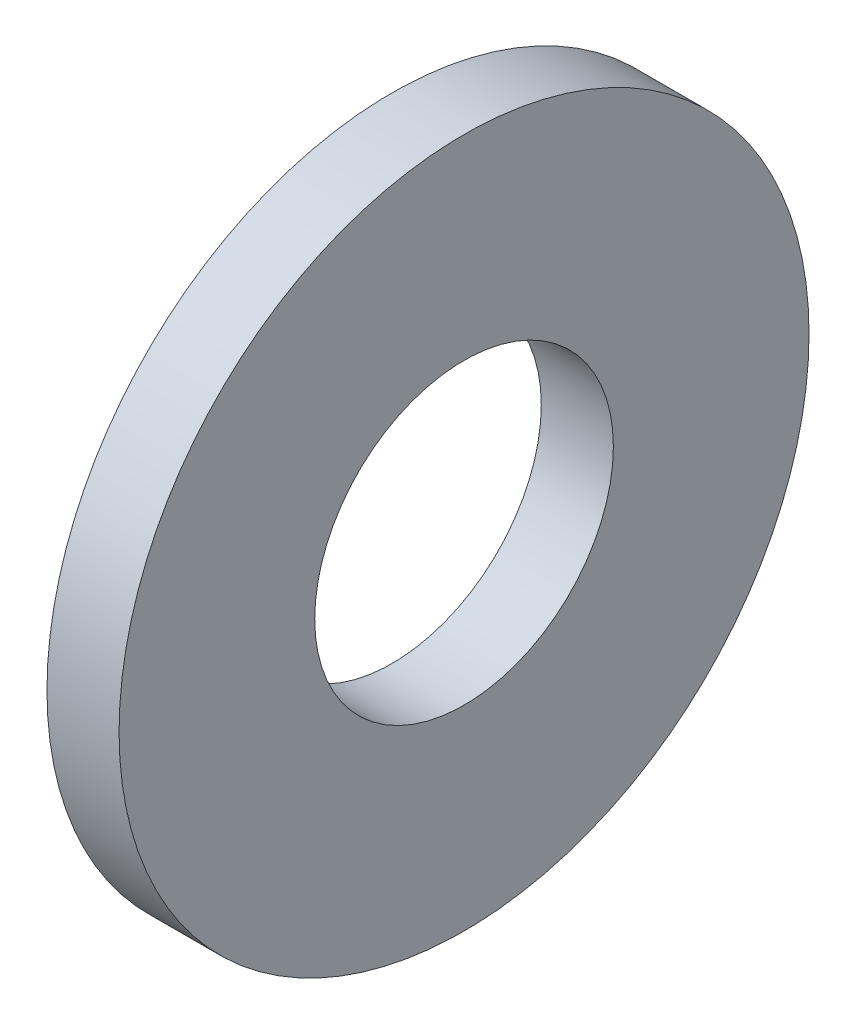
from build123d import *

# Parameters (mm, degrees)
SKETCH1_W = 1.2446
SKETCH1_H = 3.3782


with BuildPart() as part:
    # Sketch1 → Base-Revolve (revolve)
    with BuildSketch(Plane.XY, mode=Mode.PRIVATE) as base_revolve_sk:
        with Locations((-0.6223, 4.2672)):
            Rectangle(SKETCH1_W, SKETCH1_H)
    revolve(base_revolve_sk.sketch.rotate(Axis((-34.925, 0, 0), (1, 0, 0)), 90), axis=Axis((-34.925, 0, 0), (1, 0, 0)))


solid = part.part
